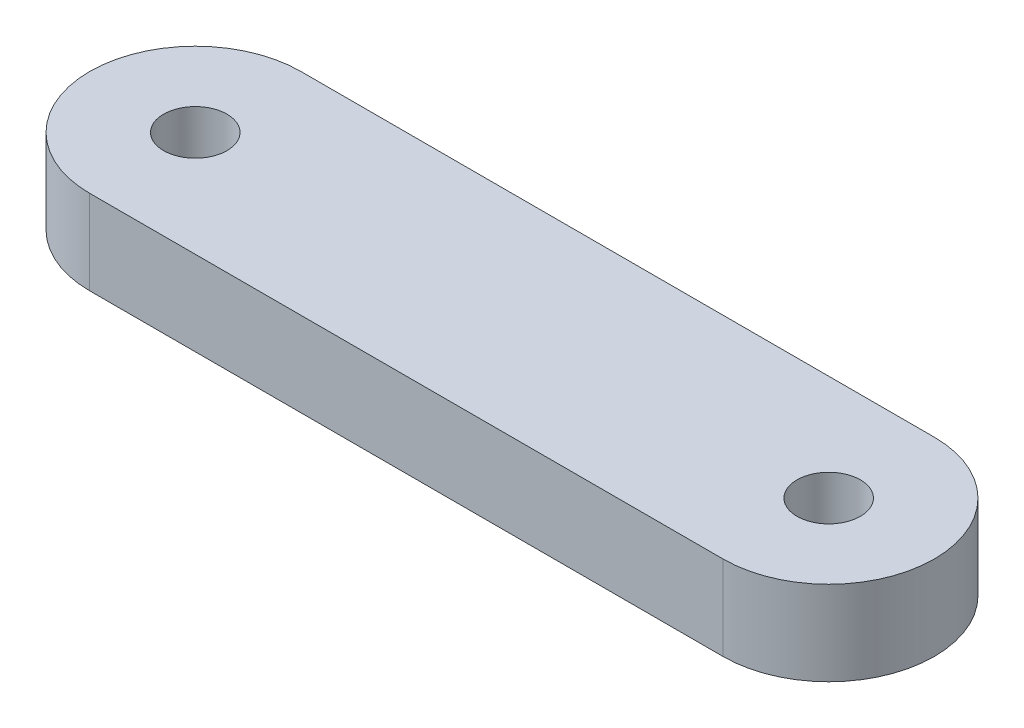
from build123d import *

# Parameters (mm, degrees)
SKETCH_1_R          = 15
EXTRUDE_1_DEPTH     = 80
SKETCH_2_W          = 500
SKETCH_2_H          = 40
CUT_EXTRUDE_3_DEPTH = 120


with BuildPart() as part:
    # 草图1 → 凸台-拉伸1 (new body)
    with BuildSketch(Plane(origin=(0, 0, 0), x_dir=(1, 0, 0), z_dir=(0, 1, 0))):
        with BuildLine():
            Line((0, 50), (300, 50))
            ThreePointArc((300, 50), (350, 0), (300, -50))
            Line((300, -50), (0, -50))
            ThreePointArc((0, -50), (-50, 0), (0, 50))
        make_face()
        with Locations(Location((0, 0, 0), (0, 0, 270))):
            Circle(SKETCH_1_R, mode=Mode.SUBTRACT)
        with Locations(Location((300, 0, 0), (0, 0, 270))):
            Circle(SKETCH_1_R, mode=Mode.SUBTRACT)
    extrude(amount=EXTRUDE_1_DEPTH)

    # 草图2 → 切除-拉伸3 (cut)
    with BuildSketch(Plane.XY.offset(50)):
        with Locations((150, 80)):
            Rectangle(SKETCH_2_W, SKETCH_2_H)
        with Locations((150, 0)):
            Rectangle(SKETCH_2_W, SKETCH_2_H)
    extrude(amount=-CUT_EXTRUDE_3_DEPTH, mode=Mode.SUBTRACT)


solid = part.part
